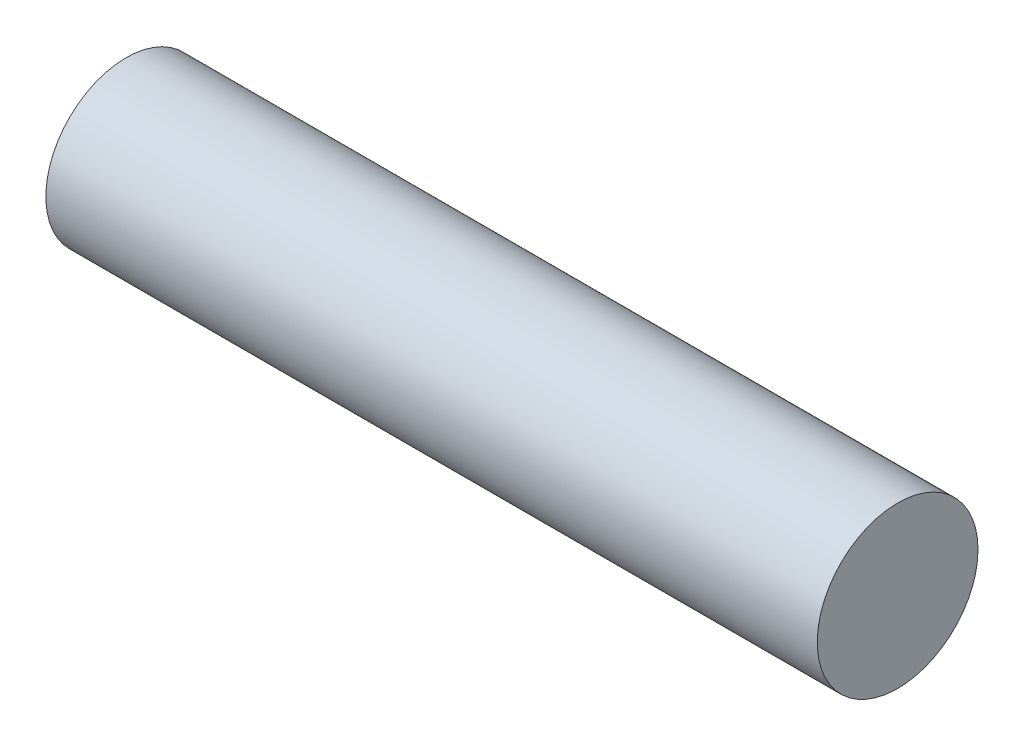
from build123d import *

# Parameters (mm, degrees)
SKETCH1_R           = 12.5
BOSS_EXTRUDE1_DEPTH = 120


with BuildPart() as part:
    # Sketch1 → Boss-Extrude1 (new body)
    with BuildSketch(Plane(origin=(0, 0, 0), x_dir=(0, 0, -1), z_dir=(1, 0, 0))):
        Circle(SKETCH1_R)
    extrude(amount=BOSS_EXTRUDE1_DEPTH)


solid = part.part
